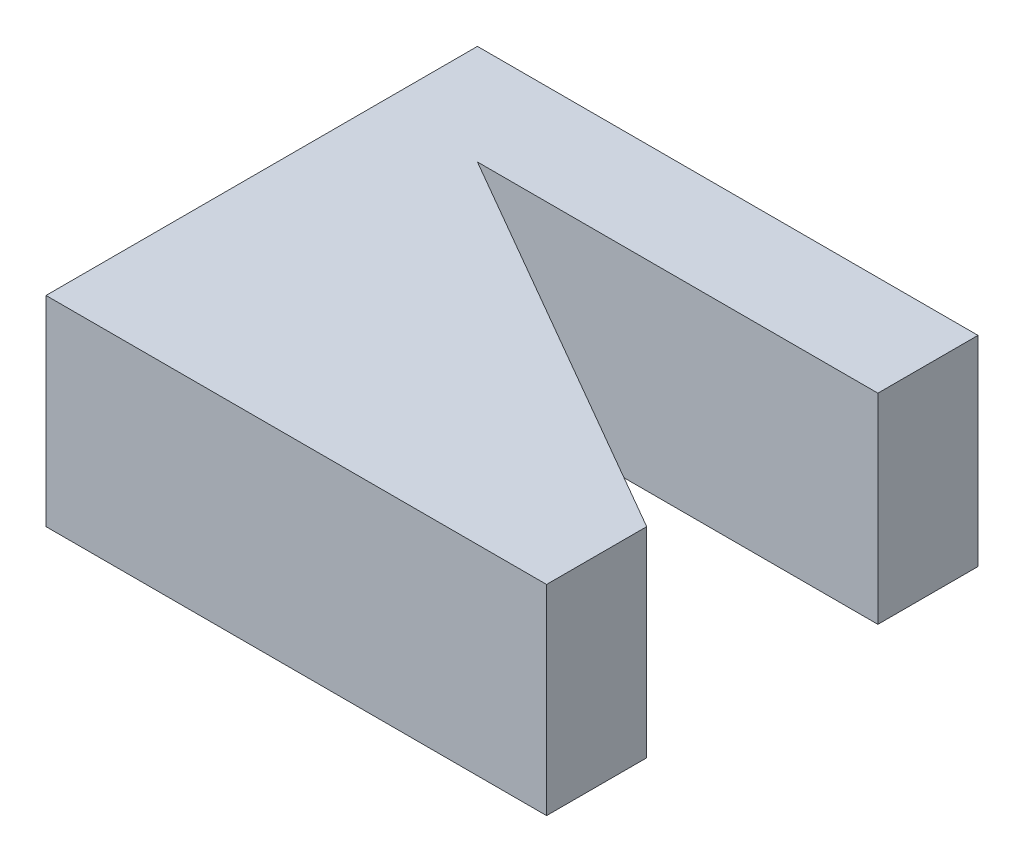
from build123d import *

# Parameters (mm, degrees)
BOSS_EXTRUDE1_DEPTH = 20


with BuildPart() as part:
    # Sketch1 → Boss-Extrude1 (new body)
    with BuildSketch(Plane(origin=(0, 0, 0), x_dir=(1, 0, 0), z_dir=(0, 1, 0))):
        Polygon((0, 0), (0, -43.094010768), (50, -43.094010768), (50, -33.094010768), (10, -10), (50, -10), (50, 0), align=None)
    extrude(amount=BOSS_EXTRUDE1_DEPTH)


solid = part.part
